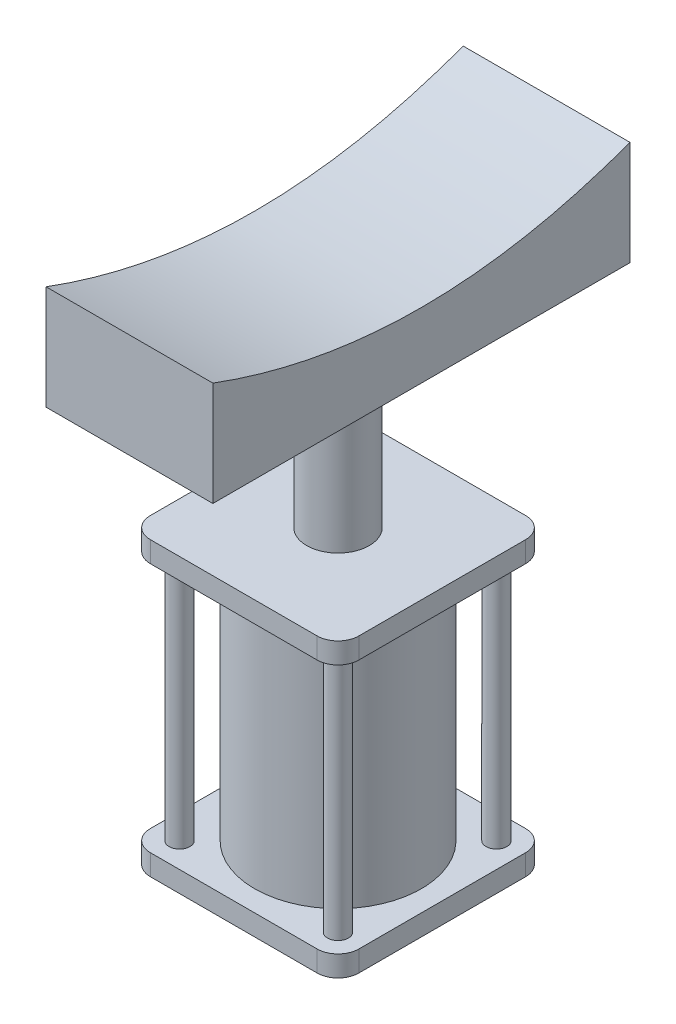
from build123d import *

# Parameters (mm, degrees)
SKETCH1_W           = 100
SKETCH1_H           = 100
BOSS_EXTRUDE1_DEPTH = 10
SKETCH2_R           = 40
BOSS_EXTRUDE2_DEPTH = 120
SKETCH3_W           = 100
SKETCH3_H           = 100
BOSS_EXTRUDE3_DEPTH = 10
SKETCH4_R           = 15
BOSS_EXTRUDE4_DEPTH = 80
SKETCH5_R           = 5
BOSS_EXTRUDE5_DEPTH = 120
FILLET1_R           = 10
SKETCH6_W           = 80
SKETCH6_H           = 200
BOSS_EXTRUDE6_DEPTH = 50
CUT_EXTRUDE3_DEPTH  = 1500


with BuildPart() as part:
    # Sketch1 → Boss-Extrude1 (new body)
    with BuildSketch(Plane(origin=(0, 0, 0), x_dir=(1, 0, 0), z_dir=(0, 1, 0))):
        Rectangle(SKETCH1_W, SKETCH1_H)
    extrude(amount=BOSS_EXTRUDE1_DEPTH)



with BuildPart() as body_2:
    # Sketch2 → Boss-Extrude2 (new body)
    with BuildSketch(Plane(origin=(0, 10, 0), x_dir=(1, 0, 0), z_dir=(0, 1, 0))):
        with Locations(Location((0, 0, 0), (0, 0, 270))):
            Circle(SKETCH2_R)
    extrude(amount=BOSS_EXTRUDE2_DEPTH)


with BuildPart() as body_3:
    # Sketch3 → Boss-Extrude3 (new body)
    with BuildSketch(Plane(origin=(0, 130, 0), x_dir=(1, 0, 0), z_dir=(0, 1, 0))):
        Rectangle(SKETCH3_W, SKETCH3_H)
    extrude(amount=BOSS_EXTRUDE3_DEPTH)


with BuildPart() as body_4:
    # Sketch4 → Boss-Extrude4 (new body)
    with BuildSketch(Plane(origin=(0, 140, 0), x_dir=(1, 0, 0), z_dir=(0, 1, 0))):
        with Locations(Location((0, 0, 0), (0, 0, 270))):
            Circle(SKETCH4_R)
    extrude(amount=BOSS_EXTRUDE4_DEPTH)


with BuildPart() as part_1:
    add(part.part)

    add(body_2.part)  # Boss-Extrude5 merges body 2

    add(body_3.part)  # Boss-Extrude5 merges body 3
    # Sketch5 → Boss-Extrude5 (add)
    with BuildSketch(Plane(origin=(0, 10, 0), x_dir=(1, 0, 0), z_dir=(0, 1, 0))):
        with Locations(Location((-38, 38, 0), (0, 0, 90))):
            Circle(SKETCH5_R)
        with Locations(Location((38, 38, 0), (0, 0, 90))):
            Circle(SKETCH5_R)
        with Locations(Location((38, -38, 0), (0, 0, 90))):
            Circle(SKETCH5_R)
        with Locations(Location((-38, -38, 0), (0, 0, 90))):
            Circle(SKETCH5_R)
    extrude(amount=BOSS_EXTRUDE5_DEPTH)

    # Fillet1
    fillet1_edges = [part_1.edges().sort_by_distance(p)[0] for p in [
        (-50, 135, -50),
        (-50, 135, 50),
        (50, 135, 50),
        (50, 135, -50),
        (50, 5, 50),
        (-50, 5, 50),
        (-50, 5, -50),
        (50, 5, -50),
    ]]
    fillet(fillet1_edges, radius=FILLET1_R)


with BuildPart() as body_3_2:
    # Sketch6 → Boss-Extrude6 (new body)
    with BuildSketch(Plane(origin=(0, 220, 0), x_dir=(1, 0, 0), z_dir=(0, 1, 0))):
        Rectangle(SKETCH6_W, SKETCH6_H)
    extrude(amount=BOSS_EXTRUDE6_DEPTH)

    # Sketch7 → Cut-Extrude3 (cut)
    with BuildSketch(Plane(origin=(40, 0, 0), x_dir=(0, 0, -1), z_dir=(1, 0, 0))):
        with BuildLine():
            Line((-100, 270), (100, 270))
            add(Edge.make_bspline(
                [(-100, 270), (0, 232.788897751), (100, 270)],
                knots=[0, 0, 0, 1, 1, 1], degree=2))
        make_face()
    extrude(amount=-CUT_EXTRUDE3_DEPTH, mode=Mode.SUBTRACT)


solid = Compound([body_4.part, part_1.part, body_3_2.part])
